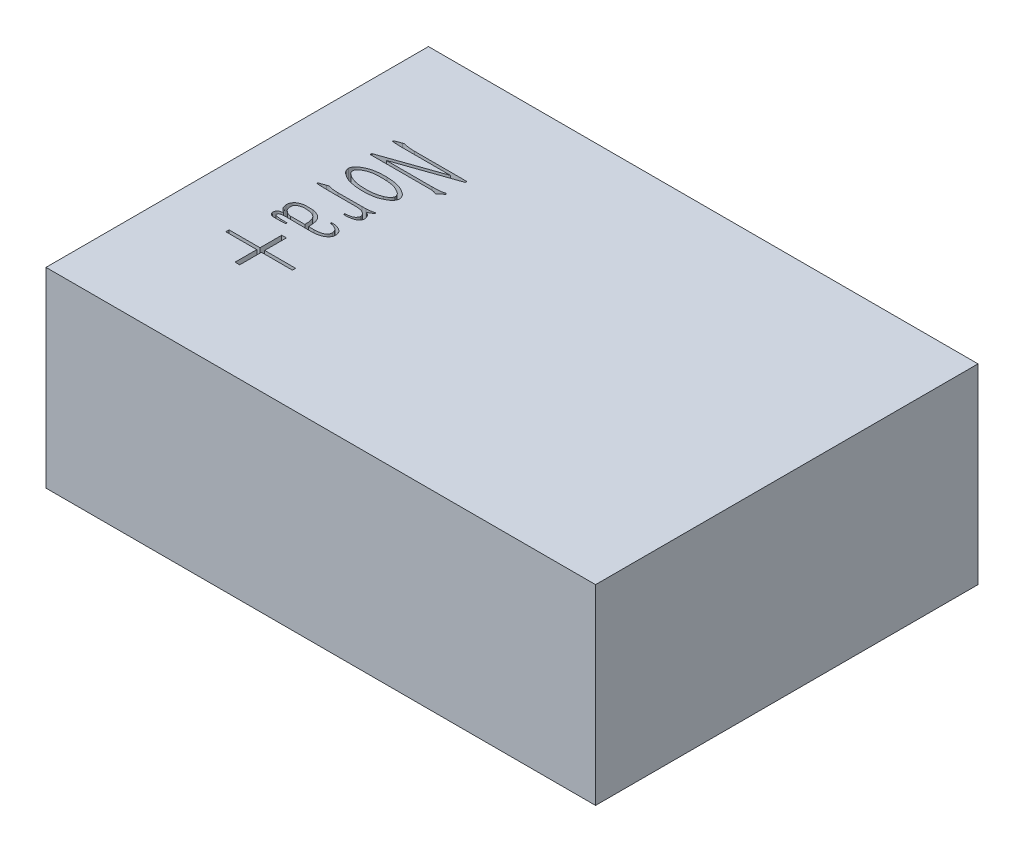
from build123d import *

# Parameters (mm, degrees)
SKETCH_1_W          = 66.1
SKETCH_1_H          = 46
EXTRUDE_1_DEPTH     = 23
CUT_EXTRUDE_1_DEPTH = 2


with BuildPart() as part:
    # 草图1 → 凸台-拉伸1 (new body)
    with BuildSketch(Plane(origin=(0, 0, 0), x_dir=(1, 0, 0), z_dir=(0, 1, 0))):
        Rectangle(SKETCH_1_W, SKETCH_1_H)
    extrude(amount=EXTRUDE_1_DEPTH)

    # 草图2 → 切除-拉伸1 (cut)
    # profile 1 of 5: a face of its own
    with BuildSketch(Plane(origin=(0, 23, 0), x_dir=(1, 0, 0), z_dir=(0, 1, 0))):
        Polygon((-21.661887618, -8.083952308), (-17.939523976, -8.083952308), (-17.939523976, -8.474761797), (-21.661887618, -8.474761797), (-21.661887618, -11.086607388), (-22.222950745, -11.086607388), (-22.222950745, -8.474761797), (-25.945314387, -8.474761797), (-25.945314387, -8.083952308), (-22.222950745, -8.083952308), (-22.222950745, -5.472106718), (-21.661887618, -5.472106718), align=None)
    # profile 2 of 5: a face of its own
    with BuildSketch(Plane(origin=(0, 23, 0), x_dir=(1, 0, 0), z_dir=(0, 1, 0))):
        with BuildLine():
            Line((-23.17675806, -3.871722516), (-23.17675806, -4.041976154))
            add(Edge.make_bspline(
                [(-23.17675806, -4.041976154), (-23.219314611, -4.044102226), (-23.29860923, -4.048063687), (-23.408948294, -4.050800053), (-23.501097931, -4.056349619), (-23.556598719, -4.055773499), (-23.581110452, -4.055519057)],
                knots=[0, 0, 0, 0, 1.263586259, 2.354410554, 3.273231046, 4, 4, 4, 4], degree=3))
            Line((-23.581110452, -4.055519057), (-24.364664129, -4.080670163))
            add(Edge.make_bspline(
                [(-24.364664129, -4.080670163), (-24.440879492, -4.079092062), (-24.581072116, -4.076189259), (-24.748206819, -4.052605175), (-24.864970013, -4.020427707), (-24.938100641, -3.977060825), (-25.008304503, -3.927334262), (-25.067108756, -3.861776159), (-25.113265707, -3.786852666), (-25.14485199, -3.706269957), (-25.161322896, -3.62091031), (-25.156915105, -3.505347312), (-25.124247668, -3.369740864), (-25.058485348, -3.249275556), (-24.982244822, -3.176083195), (-24.91102467, -3.130405638), (-24.82471014, -3.099116637), (-24.762724252, -3.084303745), (-24.730322512, -3.076560636)],
                knots=[0, 0, 0, 0, 2.045255481, 3.762098929, 4.523462258, 5.275313126, 6.03034813, 6.827124521, 7.620128275, 8.382278949, 9.139693271, 9.936469662, 11.469500713, 12.850643965, 13.54871997, 14.288508277, 15.105355874, 16, 16, 16, 16], degree=3))
            Line((-24.730322512, -3.076560636), (-24.482680856, -3.010780821))
            add(Edge.make_bspline(
                [(-24.482680856, -3.010780821), (-24.557684545, -2.953128997), (-24.705773641, -2.839299841), (-24.878044488, -2.682404623), (-24.998854995, -2.537409398), (-25.060173515, -2.400267045), (-25.106342942, -2.243469959), (-25.117294293, -2.13021342), (-25.123066701, -2.070516408)],
                knots=[0, 0, 0, 0, 1.434757964, 2.832820803, 3.529589203, 4.277890945, 5.09228408, 6, 6, 6, 6], degree=3))
            add(Edge.make_bspline(
                [(-25.123066701, -2.070516408), (-25.125428105, -2.029883277), (-25.130160404, -1.948453704), (-25.117992527, -1.827385702), (-25.090666287, -1.708102899), (-25.04547042, -1.593729889), (-24.989236836, -1.482695933), (-24.914243451, -1.385008935), (-24.830055079, -1.294952073), (-24.697178208, -1.19315872), (-24.508627313, -1.08956379), (-24.299779611, -1.018036621), (-24.116571596, -0.980911663), (-23.961537478, -0.959371845), (-23.790217376, -0.948836035), (-23.607556236, -0.945301203), (-23.42375284, -0.948487944), (-23.249485271, -0.950519227), (-23.09023513, -0.961216318), (-22.989080539, -0.969555025), (-22.940724607, -0.97354126)],
                knots=[0, 0, 0, 0, 0.777551584, 1.558228232, 2.318262248, 3.110932152, 3.9055195, 4.690084972, 5.457887851, 6.257439032, 7.880954419, 9.55063218, 10.457885192, 11.454040442, 12.542117684, 13.738951792, 14.94793039, 16.058433155, 17.071853555, 18, 18, 18, 18], degree=3))
            add(Edge.make_bspline(
                [(-22.940724607, -0.97354126), (-22.896075686, -0.981213619), (-22.802681951, -0.997262165), (-22.66127233, -1.036531568), (-22.512658772, -1.088427363), (-22.358434774, -1.147502647), (-22.205898208, -1.223103185), (-22.065396809, -1.320404832), (-21.940303449, -1.438890886), (-21.830221257, -1.572728872), (-21.734900595, -1.716863472), (-21.661286717, -1.869415333), (-21.605736089, -2.026260318), (-21.575532148, -2.185821694), (-21.556190408, -2.338707514), (-21.53775353, -2.479136417), (-21.526311272, -2.6056731), (-21.521150783, -2.685096008), (-21.518719785, -2.722510456)],
                knots=[0, 0, 0, 0, 0.868431064, 1.81652809, 2.810007955, 3.887191432, 4.982401979, 6.066592407, 7.151629087, 8.275993379, 9.384048763, 10.457177181, 11.51718188, 12.565066865, 13.563844918, 14.473570742, 15.280931539, 16, 16, 16, 16], degree=3))
            Line((-21.518719785, -2.722510456), (-21.505176882, -2.958543909))
            Line((-21.505176882, -2.958543909), (-20.839639932, -2.958543909))
            add(Edge.make_bspline(
                [(-20.839639932, -2.958543909), (-20.733108295, -2.955324029), (-20.524978537, -2.949033381), (-20.270872961, -2.914003835), (-20.081729071, -2.8702673), (-19.955902693, -2.829957225), (-19.842652146, -2.78546754), (-19.744143715, -2.733369077), (-19.658121307, -2.675369176), (-19.58611845, -2.611940963), (-19.528886957, -2.543198292), (-19.471190014, -2.446207994), (-19.427531462, -2.30872774), (-19.428663981, -2.194651224), (-19.429243313, -2.136296223)],
                knots=[0, 0, 0, 0, 2.080978105, 4.065585425, 4.997522146, 5.870008331, 6.644300162, 7.371235559, 8.042087705, 8.666634005, 9.239217544, 9.781482339, 10.865133649, 12, 12, 12, 12], degree=3))
            add(Edge.make_bspline(
                [(-19.429243313, -2.136296223), (-19.434482384, -2.096071203), (-19.444708029, -2.017559802), (-19.479994932, -1.906426332), (-19.530864938, -1.805622636), (-19.598317474, -1.716685031), (-19.676245368, -1.634163792), (-19.767462152, -1.560859114), (-19.871207113, -1.496837085), (-19.982307265, -1.443450934), (-20.090318333, -1.398435776), (-20.187642555, -1.364765999), (-20.269926908, -1.343563043), (-20.320409911, -1.340524523), (-20.342421919, -1.339199643)],
                knots=[0, 0, 0, 0, 1.112350154, 2.171090771, 3.185028507, 4.198192423, 5.225501344, 6.296029027, 7.401873327, 8.566308854, 9.678094793, 10.613494702, 11.395444706, 12, 12, 12, 12], degree=3))
            Line((-20.342421919, -1.339199643), (-20.537826664, -1.32565674))
            Line((-20.537826664, -1.32565674), (-20.537826664, -1.155403101))
            add(Edge.make_bspline(
                [(-20.537826664, -1.155403101), (-20.468174579, -1.160442397), (-20.337788546, -1.169875765), (-20.148020648, -1.185443606), (-19.964193153, -1.217264213), (-19.774549099, -1.272036102), (-19.573731164, -1.353063395), (-19.407489337, -1.447931582), (-19.276935508, -1.539102897), (-19.191158383, -1.62360972), (-19.117903769, -1.719677722), (-19.043541223, -1.863117509), (-18.976061891, -2.054540886), (-18.972481322, -2.214359517), (-18.970719309, -2.293006959)],
                knots=[0, 0, 0, 0, 1.154025256, 2.16029107, 3.144882328, 4.230981057, 5.416315329, 6.71427664, 7.38570331, 8.041299283, 8.695594898, 9.372579692, 10.707035081, 12, 12, 12, 12], degree=3))
            add(Edge.make_bspline(
                [(-18.970719309, -2.293006959), (-18.979222625, -2.343783255), (-18.995976019, -2.44382368), (-19.052713758, -2.58535815), (-19.129673387, -2.71651806), (-19.23184354, -2.83096773), (-19.346054365, -2.933290369), (-19.470054748, -3.023165929), (-19.604966933, -3.096930075), (-19.795693965, -3.17550976), (-20.044340945, -3.246496165), (-20.301842107, -3.2895373), (-20.519684162, -3.305439359), (-20.70338587, -3.318326633), (-20.907977611, -3.322970073), (-21.051168242, -3.323779448), (-21.125975597, -3.324202292)],
                knots=[0, 0, 0, 0, 0.824180443, 1.623815973, 2.431517052, 3.253354219, 4.074278306, 4.890096524, 5.705454959, 6.535916319, 8.196613251, 9.84383627, 10.716324781, 11.701618561, 12.799252193, 14, 14, 14, 14], degree=3))
            Line((-21.125975597, -3.324202292), (-23.685584276, -3.297116486))
            add(Edge.make_bspline(
                [(-23.685584276, -3.297116486), (-23.781706284, -3.297868043), (-23.967118322, -3.299317739), (-24.192417528, -3.317161176), (-24.354555142, -3.338531111), (-24.45761651, -3.353666584), (-24.541788493, -3.379890357), (-24.611126369, -3.405484326), (-24.66533962, -3.438089571), (-24.700367543, -3.483707968), (-24.718613571, -3.53893446), (-24.717414427, -3.578162639), (-24.716779609, -3.598929754)],
                knots=[0, 0, 0, 0, 2.460564264, 4.746241194, 5.778379059, 6.649689729, 7.407196438, 8.02957908, 8.542468912, 9.001508542, 9.471405834, 10, 10, 10, 10], degree=3))
            add(Edge.make_bspline(
                [(-24.716779609, -3.598929754), (-24.713497743, -3.623929758), (-24.706679099, -3.675871593), (-24.654012484, -3.725488089), (-24.596754913, -3.757970961), (-24.531960505, -3.776292865), (-24.452137181, -3.799506284), (-24.324905327, -3.819123305), (-24.167622266, -3.840400951), (-24.042895466, -3.853898933), (-23.985462843, -3.860114313)],
                knots=[0, 0, 0, 0, 0.710002232, 1.475152537, 1.967762764, 2.61635, 3.407853986, 4.373471422, 6.330101899, 8, 8, 8, 8], degree=3))
            Line((-23.985462843, -3.860114313), (-23.17675806, -3.871722516))
        make_face()
        with BuildLine():
            Line((-23.712670082, -2.958543909), (-21.961766186, -2.958543909))
            add(Edge.make_bspline(
                [(-21.961766186, -2.958543909), (-21.962192649, -2.892109535), (-21.963058152, -2.757281652), (-21.967597106, -2.585752415), (-21.975010214, -2.439227514), (-21.998635278, -2.318107146), (-22.029206651, -2.184689994), (-22.072299622, -2.044705649), (-22.125943123, -1.906316386), (-22.19316328, -1.779226653), (-22.278966238, -1.6729154), (-22.378246043, -1.583642814), (-22.489129562, -1.511393165), (-22.608932871, -1.448411011), (-22.73848229, -1.396295493), (-22.87869968, -1.355932902), (-23.029723986, -1.32608175), (-23.19141591, -1.299122072), (-23.366236089, -1.288469744), (-23.547494657, -1.278708073), (-23.727764199, -1.283402366), (-23.897955669, -1.295963106), (-24.052701543, -1.329784004), (-24.148237916, -1.362218239), (-24.194410491, -1.377893652)],
                knots=[0, 0, 0, 0, 1.300832257, 2.640025766, 3.361640179, 4.169294014, 5.051507144, 6.042207574, 7.034195047, 7.955408423, 8.844913066, 9.694431677, 10.559576639, 11.429501443, 12.341755164, 13.288918479, 14.28211104, 15.355562798, 16.495591445, 17.709012437, 18.909018478, 20.024939626, 21.045456515, 22, 22, 22, 22], degree=3))
            add(Edge.make_bspline(
                [(-24.194410491, -1.377893652), (-24.236741442, -1.39303966), (-24.316045678, -1.421414704), (-24.421463865, -1.475777685), (-24.506832787, -1.53464045), (-24.568995889, -1.602929671), (-24.613191474, -1.676961289), (-24.641155078, -1.758199314), (-24.662220413, -1.845673625), (-24.663752539, -1.907217144), (-24.664542697, -1.938956779)],
                knots=[0, 0, 0, 0, 1.354296933, 2.537185646, 3.568037332, 4.462790933, 5.299897474, 6.148891186, 7.045333799, 8, 8, 8, 8], degree=3))
            add(Edge.make_bspline(
                [(-24.664542697, -1.938956779), (-24.664900999, -1.995172956), (-24.6656736, -2.116390852), (-24.636902804, -2.271387869), (-24.592795546, -2.403098389), (-24.528194123, -2.498979194), (-24.447954456, -2.594203758), (-24.345996335, -2.679905109), (-24.238478939, -2.755871088), (-24.132590294, -2.818862674), (-24.033068225, -2.867789168), (-23.965187423, -2.884769127), (-23.933225932, -2.892764094)],
                knots=[0, 0, 0, 0, 1.284024769, 2.768718719, 3.585591946, 4.441127923, 5.393369031, 6.428850999, 7.476872054, 8.403035282, 9.248073488, 10, 10, 10, 10], degree=3))
            Line((-23.933225932, -2.892764094), (-23.712670082, -2.958543909))
        make_face(mode=Mode.SUBTRACT)
    # profile 3 of 5: a face of its own
    with BuildSketch(Plane(origin=(0, 23, 0), x_dir=(1, 0, 0), z_dir=(0, 1, 0))):
        with BuildLine():
            add(Edge.make_bspline(
                [(-19.481480225, 2.004349653), (-19.435235504, 1.978011628), (-19.344806907, 1.926509301), (-19.218166173, 1.83719427), (-19.105156337, 1.7294739), (-19.032298689, 1.614837274), (-18.986870104, 1.505939239), (-18.959077756, 1.406088061), (-18.946507742, 1.289427034), (-18.936005826, 1.161560571), (-18.9477633, 1.024338147), (-19.008250754, 0.892336921), (-19.108905037, 0.771253456), (-19.197908261, 0.70738777), (-19.245446771, 0.673275752)],
                knots=[0, 0, 0, 0, 1.147037245, 2.242958068, 3.33437091, 4.491477439, 5.139653994, 5.875030394, 6.716699115, 7.663857145, 8.64352609, 9.645923218, 10.742637644, 12, 12, 12, 12], degree=3))
            add(Edge.make_bspline(
                [(-19.245446771, 0.673275752), (-19.280437412, 0.651722224), (-19.353841911, 0.606506535), (-19.479654243, 0.554253666), (-19.620556532, 0.504712544), (-19.774860587, 0.469291131), (-19.927416913, 0.439953558), (-20.067797848, 0.415572899), (-20.191197027, 0.400976708), (-20.268227, 0.3993144), (-20.303727911, 0.39854829)],
                knots=[0, 0, 0, 0, 0.891494007, 1.870204965, 2.951262865, 4.133777421, 5.304279666, 6.326928783, 7.228929343, 8, 8, 8, 8], degree=3))
            Line((-20.303727911, 0.39854829), (-20.669386293, 0.39854829))
            Line((-20.669386293, 0.39854829), (-20.669386293, 0.555259026))
            add(Edge.make_bspline(
                [(-20.669386293, 0.555259026), (-20.557734487, 0.566324493), (-20.34566755, 0.587341795), (-20.088438951, 0.628602666), (-19.905305208, 0.683677376), (-19.783605418, 0.734046476), (-19.679714272, 0.804113396), (-19.59014041, 0.883899482), (-19.522046631, 0.975257671), (-19.467664722, 1.068666276), (-19.442863517, 1.170513659), (-19.4415241, 1.238762103), (-19.440851515, 1.273032888)],
                knots=[0, 0, 0, 0, 2.133825722, 4.052902506, 4.937192036, 5.766297754, 6.545010451, 7.308714639, 8.034575401, 8.703870187, 9.349151657, 10, 10, 10, 10], degree=3))
            add(Edge.make_bspline(
                [(-19.440851515, 1.273032888), (-19.447735825, 1.309594573), (-19.461587267, 1.383157797), (-19.510565527, 1.48723808), (-19.579430054, 1.58586313), (-19.670801286, 1.674682354), (-19.776739305, 1.756234469), (-19.897197214, 1.824087068), (-20.031117159, 1.876286412), (-20.215802325, 1.925931313), (-20.434078249, 1.968129227), (-20.605369798, 1.975748572), (-20.682929196, 1.979198548)],
                knots=[0, 0, 0, 0, 0.71840782, 1.445458451, 2.208149164, 3.038761114, 3.903545297, 4.793251186, 5.707541125, 6.680818264, 8.497101933, 10, 10, 10, 10], degree=3))
            Line((-20.682929196, 1.979198548), (-24.026091553, 1.979198548))
            Line((-24.026091553, 1.979198548), (-25.109523798, 2.004349653))
            add(Edge.make_bspline(
                [(-25.109523798, 2.004349653), (-25.169622184, 2.009737695), (-25.279114236, 2.019554061), (-25.405741913, 2.03588024), (-25.486905601, 2.053605886), (-25.521470599, 2.069073991), (-25.546850582, 2.087449233), (-25.542845887, 2.101985373), (-25.540961995, 2.108823477)],
                knots=[0, 0, 0, 0, 2.321588645, 4.229656051, 4.946790606, 5.469173905, 5.750288332, 6, 6, 6, 6], degree=3))
            add(Edge.make_bspline(
                [(-25.540961995, 2.108823477), (-25.539257737, 2.11470628), (-25.535211199, 2.128674221), (-25.51807072, 2.155940438), (-25.467875085, 2.181748009), (-25.42380885, 2.193949927), (-25.395859462, 2.201689098)],
                knots=[0, 0, 0, 0, 0.404453484, 0.96032163, 2.07205792, 4, 4, 4, 4], degree=3))
            Line((-25.395859462, 2.201689098), (-25.227540524, 2.25392601))
            Line((-25.227540524, 2.25392601), (-24.757408318, 2.422244948))
            add(Edge.make_bspline(
                [(-24.757408318, 2.422244948), (-24.71823198, 2.436343601), (-24.648692772, 2.461369143), (-24.555937623, 2.487172557), (-24.489347974, 2.506309939), (-24.429334729, 2.509119614), (-24.363781454, 2.495932909), (-24.282213991, 2.466484655), (-24.185222679, 2.434271443), (-24.079326618, 2.401742084), (-23.97461222, 2.377690911), (-23.889032909, 2.364591924), (-23.816529211, 2.359759356), (-23.74423938, 2.356387692), (-23.6527386, 2.349872055), (-23.548845297, 2.345251582), (-23.448304899, 2.338789805), (-23.365637408, 2.336728054), (-23.308383627, 2.330717395), (-23.278658082, 2.331153207), (-23.267688981, 2.331314027)],
                knots=[0, 0, 0, 0, 1.47571181, 2.619433926, 3.418403848, 3.922161185, 4.734445483, 5.768866108, 6.998566853, 8.359163603, 9.696487312, 10.806074615, 11.425376643, 12.272966564, 13.373082184, 14.678730025, 15.961535604, 16.946199976, 17.61113448, 18, 18, 18, 18], degree=3))
            Line((-23.267688981, 2.331314027), (-20.369507726, 2.34485693))
            Line((-20.369507726, 2.34485693), (-19.899375519, 2.34485693))
            add(Edge.make_bspline(
                [(-19.899375519, 2.34485693), (-19.832200686, 2.346766993), (-19.694039925, 2.350695483), (-19.492805836, 2.381006341), (-19.31231856, 2.416704952), (-19.201583851, 2.439599418), (-19.154515851, 2.449330754)],
                knots=[0, 0, 0, 0, 1.06932638, 2.199319875, 3.234617468, 4, 4, 4, 4], degree=3))
            Line((-19.154515851, 2.449330754), (-18.945568203, 2.501567666))
            Line((-18.945568203, 2.501567666), (-18.814008574, 2.397093842))
            Line((-18.814008574, 2.397093842), (-19.481480225, 2.004349653))
        make_face()
    # profile 4 of 5: a face of its own
    with BuildSketch(Plane(origin=(0, 23, 0), x_dir=(1, 0, 0), z_dir=(0, 1, 0))):
        with BuildLine():
            add(Edge.make_bspline(
                [(-21.961766186, 6.901463401), (-21.853379345, 6.897087583), (-21.642828572, 6.888587178), (-21.336918523, 6.863292341), (-21.050957952, 6.828864978), (-20.785209732, 6.7854965), (-20.540577473, 6.728920665), (-20.316140654, 6.663836858), (-20.111120161, 6.588999581), (-19.928023191, 6.501464768), (-19.764405288, 6.408935807), (-19.615327349, 6.323006562), (-19.483000251, 6.23919924), (-19.366505402, 6.159794816), (-19.269695273, 6.078431048), (-19.185398455, 6.004569512), (-19.118951177, 5.931286454), (-19.055813909, 5.838960565), (-18.998297233, 5.729493299), (-18.946528533, 5.604021087), (-18.912991896, 5.486367883), (-18.908833947, 5.409350429), (-18.906874195, 5.373050055)],
                knots=[0, 0, 0, 0, 1.764634521, 3.427954541, 4.992196183, 6.449700333, 7.806241009, 9.074501551, 10.249686689, 11.352583265, 12.371647559, 13.307368702, 14.151493099, 14.919911991, 15.598324322, 16.207396272, 16.742379693, 17.202230901, 18.023686107, 18.748462212, 19.410116977, 20, 20, 20, 20], degree=3))
            add(Edge.make_bspline(
                [(-18.906874195, 5.373050055), (-18.911590062, 5.336720338), (-18.921459578, 5.260688367), (-18.959741987, 5.144737605), (-19.02243419, 5.024822163), (-19.087136322, 4.919205278), (-19.158364736, 4.832227353), (-19.230444135, 4.763743156), (-19.318281657, 4.69089793), (-19.425539026, 4.619360194), (-19.547475948, 4.540421192), (-19.688594734, 4.462778249), (-19.84582443, 4.381156522), (-20.019577942, 4.297342913), (-20.21225945, 4.217198596), (-20.426060132, 4.150304087), (-20.659398075, 4.094194447), (-20.912784938, 4.050482681), (-21.185954203, 4.017710408), (-21.479103212, 3.997699154), (-21.792054959, 3.984625428), (-22.007543009, 3.988001322), (-22.118476921, 3.989739242)],
                knots=[0, 0, 0, 0, 0.583563041, 1.221299034, 1.934495109, 2.739387755, 3.192559802, 3.723702059, 4.323104031, 5.010912353, 5.778717214, 6.640149723, 7.578909276, 8.605156425, 9.717149955, 10.904820149, 12.175010999, 13.543452273, 15.004670893, 16.562387688, 18.230306584, 20, 20, 20, 20], degree=3))
            add(Edge.make_bspline(
                [(-22.118476921, 3.989739242), (-22.231380928, 3.994078142), (-22.44967082, 4.002467021), (-22.765212822, 4.02795155), (-23.058539466, 4.061555939), (-23.329522624, 4.108588307), (-23.578913555, 4.162711509), (-23.804784527, 4.231363941), (-24.008974893, 4.307813061), (-24.190857948, 4.395675902), (-24.352837476, 4.487254171), (-24.4979177, 4.575888743), (-24.626037729, 4.661510073), (-24.739296374, 4.742268273), (-24.83576501, 4.821654063), (-24.917451728, 4.896326336), (-24.982665428, 4.967590598), (-25.043536518, 5.05789758), (-25.098631338, 5.16657856), (-25.144979154, 5.292663044), (-25.176319371, 5.412790918), (-25.175635541, 5.491537462), (-25.175303613, 5.529760791)],
                knots=[0, 0, 0, 0, 1.8254638, 3.529372482, 5.113983704, 6.594112102, 7.971884292, 9.234466531, 10.405306527, 11.491273865, 12.494282261, 13.411094474, 14.237657955, 14.98385902, 15.657644954, 16.254885857, 16.771507737, 17.213728076, 18.010662647, 18.732680123, 19.384846856, 20, 20, 20, 20], degree=3))
            add(Edge.make_bspline(
                [(-25.175303613, 5.529760791), (-25.17310912, 5.568111693), (-25.168550428, 5.64777932), (-25.127252258, 5.76700721), (-25.069408033, 5.891837457), (-25.001053207, 5.997541786), (-24.92743762, 6.083944913), (-24.85406568, 6.153398048), (-24.761081686, 6.222239158), (-24.653774692, 6.296450559), (-24.526551025, 6.368033535), (-24.385762267, 6.447587516), (-24.223860215, 6.522569388), (-24.048035094, 6.605697226), (-23.851894076, 6.681131282), (-23.63732011, 6.746514663), (-23.403368961, 6.800957041), (-23.151099161, 6.841793096), (-22.880149409, 6.875627902), (-22.590850801, 6.895873054), (-22.282343864, 6.905916417), (-22.070758871, 6.902977375), (-21.961766186, 6.901463401)],
                knots=[0, 0, 0, 0, 0.609092621, 1.265288736, 1.99124151, 2.800277882, 3.259249877, 3.796866187, 4.404918809, 5.099990968, 5.873295192, 6.728228889, 7.674521439, 8.713227137, 9.825209791, 11.01753237, 12.283114261, 13.647408312, 15.085663506, 16.630395189, 18.264232863, 20, 20, 20, 20], degree=3))
        make_face()
        with BuildLine():
            add(Edge.make_bspline(
                [(-21.988851992, 6.522262115), (-22.081711899, 6.524951414), (-22.261618634, 6.530161661), (-22.523589865, 6.525377082), (-22.768914644, 6.514939446), (-22.997491413, 6.493751003), (-23.208868997, 6.463558948), (-23.402995455, 6.422139683), (-23.581530436, 6.37558673), (-23.786366527, 6.299392125), (-24.005383111, 6.203376597), (-24.225922149, 6.09100111), (-24.391167639, 5.984705919), (-24.506007854, 5.881024992), (-24.574438945, 5.777649845), (-24.627008081, 5.685796383), (-24.658398232, 5.594296695), (-24.662540343, 5.533836822), (-24.664542697, 5.504609685)],
                knots=[0, 0, 0, 0, 1.450292897, 2.809796688, 4.090023312, 5.283351425, 6.392665891, 7.421558502, 8.381527156, 9.270195791, 10.830384, 12.113972103, 13.130522017, 13.892668432, 14.507225389, 15.056901841, 15.544093346, 16, 16, 16, 16], degree=3))
            add(Edge.make_bspline(
                [(-24.664542697, 5.504609685), (-24.665380941, 5.47733877), (-24.667129159, 5.420463265), (-24.639260973, 5.334255174), (-24.601010658, 5.241710549), (-24.538965699, 5.140422431), (-24.434797818, 5.033854442), (-24.280962579, 4.921584784), (-24.073467627, 4.799909875), (-23.868047737, 4.689938061), (-23.672611399, 4.60491626), (-23.501053089, 4.547186112), (-23.311548335, 4.497527305), (-23.104179892, 4.455227784), (-22.878825888, 4.420782534), (-22.635552272, 4.393308764), (-22.373360884, 4.377773344), (-22.098626053, 4.364547624), (-21.819800272, 4.365666424), (-21.547397833, 4.374310118), (-21.285856642, 4.395361182), (-21.036158257, 4.428713025), (-20.797574781, 4.470368317), (-20.570264923, 4.524973405), (-20.353705659, 4.589957751), (-20.215089632, 4.642846263), (-20.147017175, 4.668819096)],
                knots=[0, 0, 0, 0, 0.390008479, 0.813391427, 1.287566515, 1.833704639, 2.510111583, 3.418024472, 4.567503627, 5.970969343, 6.769385843, 7.632481783, 8.573717181, 9.587807216, 10.677555774, 11.854447898, 13.110473302, 14.457701576, 15.81306122, 17.122827165, 18.380224076, 19.588121829, 20.7480868, 21.864901124, 22.951481802, 24, 24, 24, 24], degree=3))
            add(Edge.make_bspline(
                [(-20.147017175, 4.668819096), (-20.082645143, 4.698090253), (-19.962756315, 4.752605926), (-19.803389677, 4.843609035), (-19.675098525, 4.932576021), (-19.581320371, 5.026857051), (-19.512782347, 5.118297928), (-19.464214013, 5.206711605), (-19.428496134, 5.290031488), (-19.419818903, 5.346329298), (-19.41570041, 5.373050055)],
                knots=[0, 0, 0, 0, 1.597305255, 2.974879719, 4.143993945, 5.112783108, 5.966898527, 6.717206142, 7.391144642, 8, 8, 8, 8], degree=3))
            add(Edge.make_bspline(
                [(-19.41570041, 5.373050055), (-19.417005279, 5.402282254), (-19.419726604, 5.463246457), (-19.450114268, 5.554628456), (-19.492991729, 5.650110883), (-19.554886479, 5.754861451), (-19.657544978, 5.86524061), (-19.813474399, 5.977495746), (-20.02226503, 6.099589391), (-20.230387287, 6.207099151), (-20.42793635, 6.290071219), (-20.599035532, 6.347858421), (-20.788957668, 6.395191755), (-20.99458679, 6.43826518), (-21.218888013, 6.470530258), (-21.459741166, 6.494439301), (-21.718318127, 6.515394394), (-21.896586549, 6.519919882), (-21.988851992, 6.522262115)],
                knots=[0, 0, 0, 0, 0.462097373, 0.963711245, 1.513106502, 2.123568951, 2.883856956, 3.884212733, 5.159498054, 6.719369627, 7.595087039, 8.555749695, 9.580337177, 10.697680962, 11.886741469, 13.17219998, 14.536430512, 16, 16, 16, 16], degree=3))
        make_face(mode=Mode.SUBTRACT)
    # profile 5 of 5: a face of its own
    with BuildSketch(Plane(origin=(0, 23, 0), x_dir=(1, 0, 0), z_dir=(0, 1, 0))):
        with BuildLine():
            Line((-16.712923898, 8.774640365), (-16.594907172, 8.656623638))
            Line((-16.594907172, 8.656623638), (-17.287529928, 8.095560511))
            add(Edge.make_bspline(
                [(-17.287529928, 8.095560511), (-17.329549026, 8.108159665), (-17.410645091, 8.132475794), (-17.511626851, 8.167396903), (-17.596754096, 8.194860977), (-17.676090381, 8.209217309), (-17.770309794, 8.222656562), (-17.907739806, 8.236282035), (-18.065674007, 8.249735628), (-18.187141903, 8.251508487), (-18.239402544, 8.252271247)],
                knots=[0, 0, 0, 0, 1.084511269, 2.093086262, 2.642967786, 3.29347911, 4.082813896, 4.996813247, 6.707901669, 8, 8, 8, 8], degree=3))
            Line((-18.239402544, 8.252271247), (-25.304928542, 8.252271247))
            Line((-25.304928542, 8.252271247), (-25.304928542, 8.447675991))
            Line((-25.304928542, 8.447675991), (-18.305182359, 10.902810846))
            Line((-18.305182359, 10.902810846), (-24.246647402, 10.902810846))
            add(Edge.make_bspline(
                [(-24.246647402, 10.902810846), (-24.295660223, 10.903373326), (-24.400145115, 10.904572415), (-24.567224654, 10.908286892), (-24.753577387, 10.91591672), (-24.947881058, 10.928268968), (-25.124244641, 10.936385982), (-25.26213439, 10.958653578), (-25.342815992, 10.964778648), (-25.40115407, 10.9916233), (-25.379455784, 11.046341836), (-25.330038965, 11.086979341), (-25.242222509, 11.137205436), (-25.167474433, 11.162506801), (-25.123066701, 11.177538308)],
                knots=[0, 0, 0, 0, 1.181315385, 2.518312704, 4.027194975, 5.677313601, 7.204337484, 8.301252413, 8.981038328, 9.261230731, 9.611880509, 10.09544272, 10.868505073, 12, 12, 12, 12], degree=3))
            Line((-25.123066701, 11.177538308), (-24.534917768, 11.386485955))
            add(Edge.make_bspline(
                [(-24.534917768, 11.386485955), (-24.497430547, 11.400614804), (-24.434427211, 11.424360618), (-24.338964822, 11.435420566), (-24.246106733, 11.415794173), (-24.157290038, 11.389438633), (-24.06249561, 11.365253698), (-23.967837286, 11.343739694), (-23.853311551, 11.323619354), (-23.720333839, 11.29898961), (-23.567301549, 11.279982067), (-23.396160412, 11.267768337), (-23.207206317, 11.256633179), (-23.075528559, 11.256782667), (-23.006504422, 11.256861026)],
                knots=[0, 0, 0, 0, 0.928068371, 1.559768977, 2.197298342, 3.112597032, 3.715424176, 4.467347979, 5.365961908, 6.414588333, 7.606873576, 8.943562817, 10.397846823, 12, 12, 12, 12], degree=3))
            Line((-23.006504422, 11.256861026), (-16.685838092, 11.256861026))
            Line((-16.685838092, 11.256861026), (-16.685838092, 11.059521581))
            Line((-16.685838092, 11.059521581), (-23.712670082, 8.604386726))
            Line((-23.712670082, 8.604386726), (-18.252945447, 8.604386726))
            add(Edge.make_bspline(
                [(-18.252945447, 8.604386726), (-18.145876196, 8.605738384), (-17.934881537, 8.608402012), (-17.676282374, 8.620001862), (-17.483408768, 8.631967204), (-17.360430251, 8.644664632), (-17.257744379, 8.653519786), (-17.149031594, 8.666142182), (-17.029803964, 8.687287961), (-16.939149807, 8.710865262), (-16.89478574, 8.722403453)],
                knots=[0, 0, 0, 0, 1.880335359, 3.705458995, 4.545454838, 5.273463373, 5.87637858, 6.355407225, 7.195173989, 8, 8, 8, 8], degree=3))
            Line((-16.89478574, 8.722403453), (-16.712923898, 8.774640365))
        make_face()
    extrude(amount=-CUT_EXTRUDE_1_DEPTH, mode=Mode.SUBTRACT)


solid = part.part
